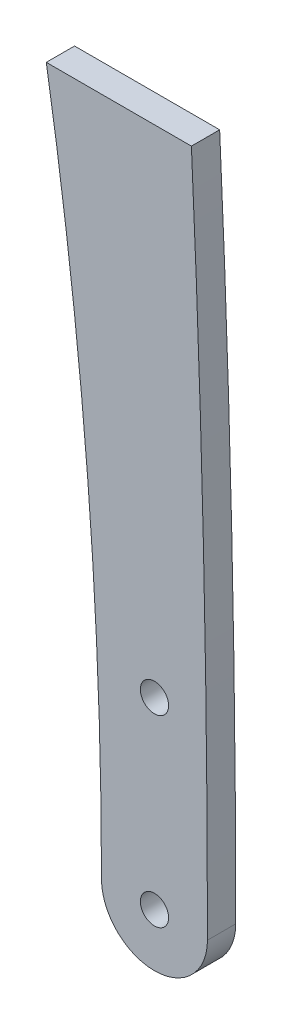
from build123d import *

# Parameters (mm, degrees)
LEG_DEPTH       = 3.048
SKETCH4_R       = 1.524
FEETHOLES_DEPTH = 3.048


with BuildPart() as part:
    # Sketch3 → Leg (new body)
    with BuildSketch(Plane.XY):
        with BuildLine():
            Line((-11.667509286, 73.310783577), (3.98378723, 73.310783577))
            ThreePointArc((3.98378723, 73.310783577), (5.282136486, 36.665610885), (5.715, 0))
            ThreePointArc((5.715, 0), (0, -5.715), (-5.715, 0))
            ThreePointArc((-5.715, 0), (-7.20557197, 36.776022608), (-11.667509286, 73.310783577))
        make_face()
    extrude(amount=LEG_DEPTH)

    # Sketch4 → FeetHoles (cut)
    with BuildSketch(Plane.XY.offset(3.048)):
        Circle(SKETCH4_R)
        with Locations((0, 19.812)):
            Circle(SKETCH4_R)
    extrude(amount=-FEETHOLES_DEPTH, mode=Mode.SUBTRACT)


solid = part.part
